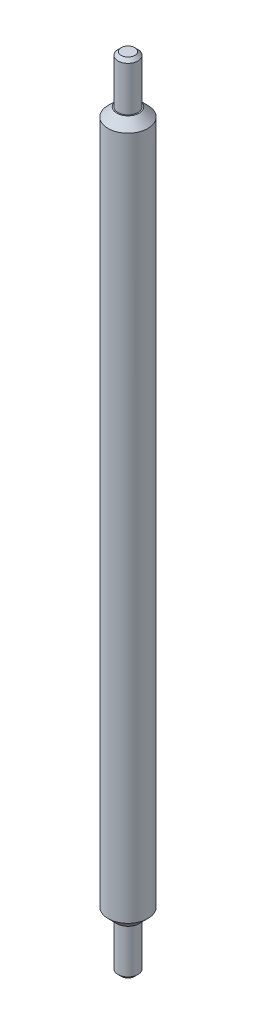
from build123d import *

# Parameters (mm, degrees)
FASE1_SIZE = 2.2
FASE2_SIZE = 0.8


with BuildPart() as part:
    # Skizze1 → Rotation1 (revolve)
    with BuildSketch(Plane.XY, mode=Mode.PRIVATE) as rotation1_sk:
        Polygon((0, 0), (2.5, 0), (2.5, -12), (5, -12), (5, -188), (2.5, -188), (2.5, -200), (0, -200), align=None)
    revolve(rotation1_sk.sketch.rotate(Axis((0, 0, 0), (0, -1, 0)), 90), axis=Axis((0, 0, 0), (0, -1, 0)))

    # Fase1
    fase1_edges = [part.edges().sort_by_distance(p)[0] for p in [
        (0, -188, -5),
        (0, -12, -5),
    ]]
    chamfer(fase1_edges, length=FASE1_SIZE)

    # Fase2
    fase2_edges = [part.edges().sort_by_distance(p)[0] for p in [
        (0, -200, -2.5),
        (0, 0, -2.5),
    ]]
    chamfer(fase2_edges, length=FASE2_SIZE)


solid = part.part
